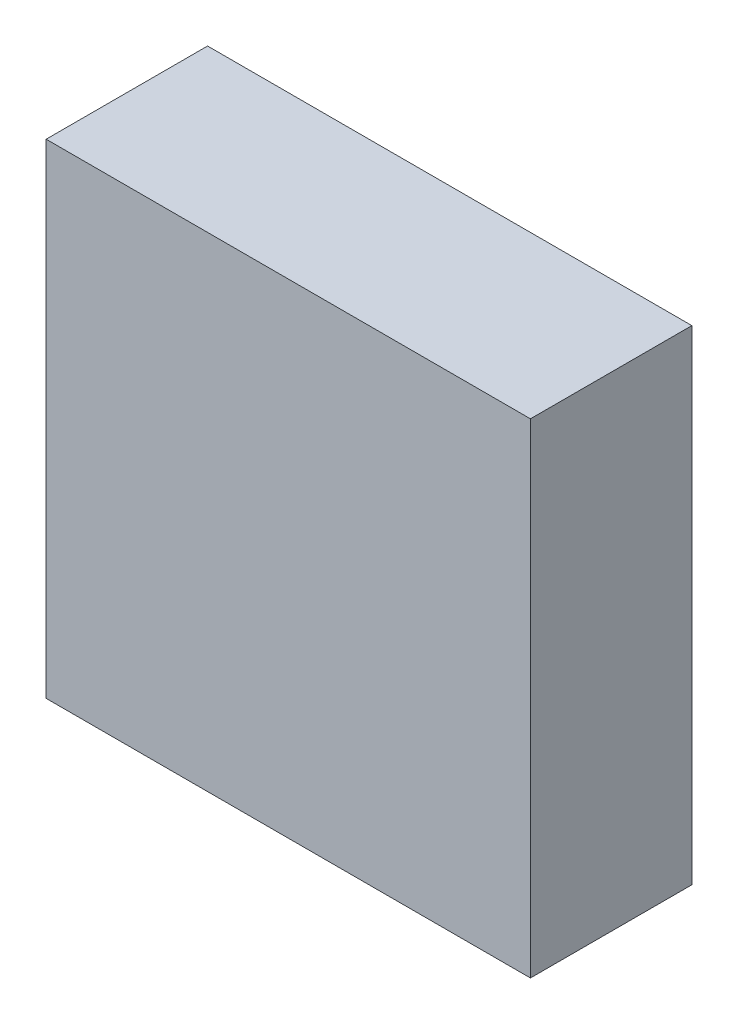
from build123d import *

# Parameters (mm, degrees)
SKETCH_1_W      = 10
SKETCH_1_H      = 30
EXTRUDE_1_DEPTH = 30
SKETCH_2_R      = 3
EXTRUDE_2_DEPTH = 10


with BuildPart() as part:
    # 草图1 → 凸台-拉伸1 (new body)
    with BuildSketch(Plane(origin=(0, 0, 0), x_dir=(0, 0, -1), z_dir=(1, 0, 0))):
        Rectangle(SKETCH_1_W, SKETCH_1_H)
    extrude(amount=EXTRUDE_1_DEPTH)

    # 草图2 → 凸台-拉伸2 (add)
    with BuildSketch(Plane(origin=(0, 0, -5), x_dir=(-1, 0, 0), z_dir=(0, 0, -1))):
        with Locations(Location((-15, -10, 0), (0, 0, 180))):
            Circle(SKETCH_2_R)
    extrude(amount=EXTRUDE_2_DEPTH)


solid = part.part
